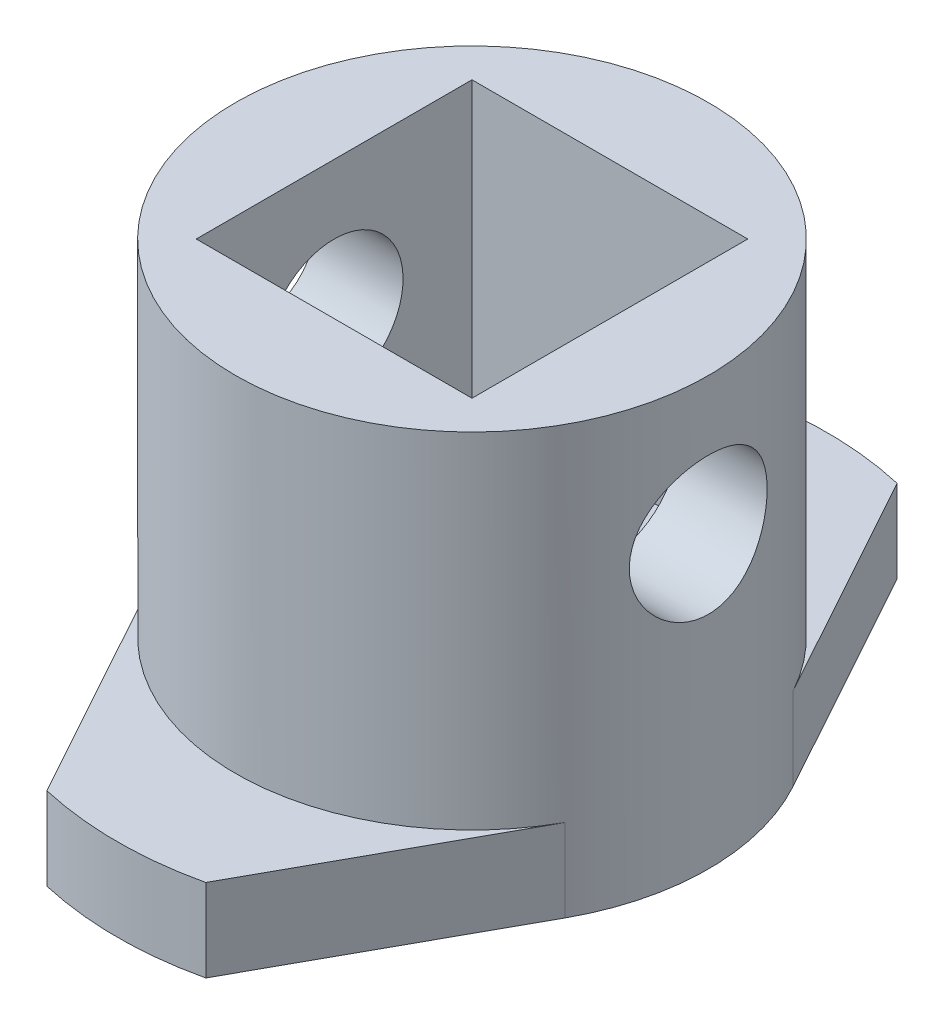
from build123d import *

# Parameters (mm, degrees)
SALIENTE_EXTRUIR1_DEPTH    = 2.4
CROQUIS2_R                 = 6.86
SALIENTE_EXTRUIR2_DEPTH    = 10
CROQUIS3_W                 = 8
CROQUIS3_H                 = 8
CORTAR_EXTRUIR1_DEPTH      = 8
CORTAR_EXTRUIR2_DEPTH      = 20.431513065
CORTAR_EXTRUIR2_DEPTH_BACK = 20.431513065
CROQUIS5_R                 = 2


with BuildPart() as part:
    # Croquis1 → Saliente-Extruir1 (new body)
    with BuildSketch(Plane(origin=(0, 0, 0), x_dir=(1, 0, 0), z_dir=(0, 1, 0))):
        with BuildLine():
            Line((-6.008085542, 3.310967853), (-2.306310946, 10.028211696))
            ThreePointArc((-2.306310946, 10.028211696), (0, 10.29), (2.306310946, 10.028211696))
            Line((2.306310946, 10.028211696), (6.008085542, 3.310967853))
            ThreePointArc((6.008085542, 3.310967853), (6.86, 0), (6.008085542, -3.310967853))
            Line((6.008085542, -3.310967853), (2.306310946, -10.028211696))
            ThreePointArc((2.306310946, -10.028211696), (0, -10.29), (-2.306310946, -10.028211696))
            Line((-2.306310946, -10.028211696), (-6.008085542, -3.310967853))
            ThreePointArc((-6.008085542, -3.310967853), (-6.86, 0), (-6.008085542, 3.310967853))
        make_face()
    extrude(amount=SALIENTE_EXTRUIR1_DEPTH)

    # Croquis2 → Saliente-Extruir2 (add)
    with BuildSketch(Plane(origin=(0, 2.4, 0), x_dir=(1, 0, 0), z_dir=(0, 1, 0))):
        with Locations(Location((0, 0, 0), (0, 0, 28.858514896))):
            Circle(CROQUIS2_R)
    extrude(amount=SALIENTE_EXTRUIR2_DEPTH)

    # Croquis3 → Cortar-Extruir1 (cut)
    with BuildSketch(Plane(origin=(0, 12.4, 0), x_dir=(1, 0, 0), z_dir=(0, 1, 0))):
        Rectangle(CROQUIS3_W, CROQUIS3_H)
    extrude(amount=-CORTAR_EXTRUIR1_DEPTH, mode=Mode.SUBTRACT)

    # Croquis5 → Cortar-Extruir2 (cut, two sides: drawn at the far end of the back side and taken through both)
    with BuildSketch(Plane(origin=(-4, 0, 0), x_dir=(0, 0, -1), z_dir=(1, 0, 0)).offset(-CORTAR_EXTRUIR2_DEPTH_BACK)):
        with Locations(Location((0, 8.4, 0), (0, 0, 270))):
            Circle(CROQUIS5_R)
    extrude(amount=CORTAR_EXTRUIR2_DEPTH + CORTAR_EXTRUIR2_DEPTH_BACK, mode=Mode.SUBTRACT)


solid = part.part
